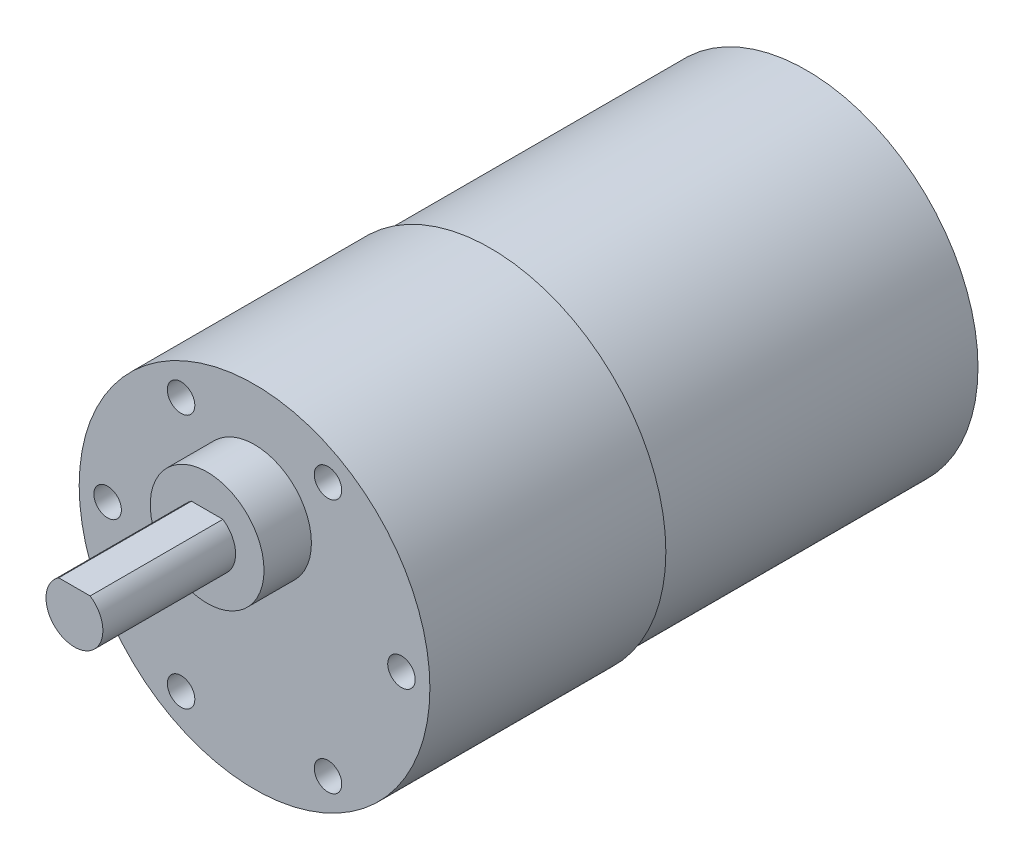
from build123d import *

# Parameters (mm, degrees)
SKETCH1_R           = 18.5
BOSS_EXTRUDE1_DEPTH = 24.892
SKETCH2_R           = 18.1
BOSS_EXTRUDE2_DEPTH = 33.33
SKETCH3_R           = 6
BOSS_EXTRUDE3_DEPTH = 5
BOSS_EXTRUDE4_DEPTH = 14
SKETCH5_R           = 1.45
CUT_EXTRUDE1_DEPTH  = 5


with BuildPart() as part:
    # Sketch1 → Boss-Extrude1 (new body)
    with BuildSketch(Plane.XY):
        Circle(SKETCH1_R)
    extrude(amount=BOSS_EXTRUDE1_DEPTH)

    # Sketch2 → Boss-Extrude2 (add)
    with BuildSketch(Plane(origin=(0, 0, 0), x_dir=(-1, 0, 0), z_dir=(0, 0, -1))):
        Circle(SKETCH2_R)
    extrude(amount=BOSS_EXTRUDE2_DEPTH)

    # Sketch3 → Boss-Extrude3 (add)
    with BuildSketch(Plane.XY.offset(24.892)):
        with Locations((0, 7)):
            Circle(SKETCH3_R)
    extrude(amount=BOSS_EXTRUDE3_DEPTH)

    # Sketch4 → Boss-Extrude4 (add)
    with BuildSketch(Plane.XY.offset(29.892)):
        with BuildLine():
            Line((1.658312395, 9.5), (-1.658312395, 9.5))
            ThreePointArc((-1.658312395, 9.5), (0, 4), (1.658312395, 9.5))
        make_face()
    extrude(amount=BOSS_EXTRUDE4_DEPTH)

    # Sketch5 → Cut-Extrude1 (cut)
    with BuildSketch(Plane.XY.offset(24.892)):
        with Locations((15.5, 0)):
            Circle(SKETCH5_R)
        with Locations((7.75, -13.423393759)):
            Circle(SKETCH5_R)
        with Locations((-7.75, -13.423393759)):
            Circle(SKETCH5_R)
        with Locations((-15.5, 0)):
            Circle(SKETCH5_R)
        with Locations((-7.75, 13.423393759)):
            Circle(SKETCH5_R)
        with Locations((7.75, 13.423393759)):
            Circle(SKETCH5_R)
    extrude(amount=-CUT_EXTRUDE1_DEPTH, mode=Mode.SUBTRACT)


solid = part.part
